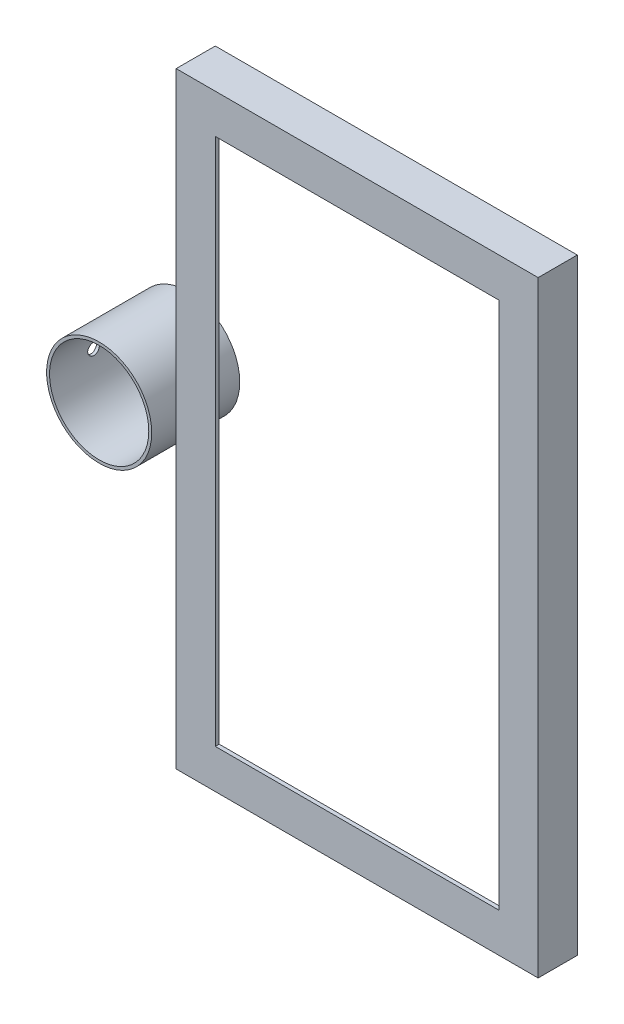
from build123d import *

# Parameters (mm, degrees)
SKETCH1_R               = 26.85
SKETCH1_R_2             = 25.35
BOSS_EXTRUDE1_DEPTH     = 45
CUT_EXTRUDE2_REACH      = 77.031
CUT_EXTRUDE2_END_RADIUS = 25.35
SKETCH2_R               = 3
SKETCH9_W               = 185
SKETCH9_H               = 310
SKETCH9_W_2             = 145
SKETCH9_H_2             = 270
BOSS_EXTRUDE2_DEPTH     = 10
SHELL3_T                = -2


with BuildPart() as part:
    # Sketch1 → Boss-Extrude1 (new body)
    with BuildSketch(Plane.XY):
        with Locations(Location((0, 0, 0), (0, 0, 180))):
            Circle(SKETCH1_R)
        with Locations(Location((0, 0, 0), (0, 0, 180))):
            Circle(SKETCH1_R_2, mode=Mode.SUBTRACT)
    extrude(amount=BOSS_EXTRUDE1_DEPTH)

    # Cut-Extrude2: up to this cylinder (the profile starts outside it)
    cut_extrude2_end = Plane(origin=(0, 0, 22.5), z_dir=(0, 0, -1)) * Cylinder(CUT_EXTRUDE2_END_RADIUS, 205.762, mode=Mode.PRIVATE)
    # Sketch2 → Cut-Extrude2 (cut, up to the surface)
    with BuildSketch(Plane.ZY.offset(26.85), mode=Mode.PRIVATE) as cut_extrude2_sk1:
        with Locations((22.5, 0)):
            Circle(SKETCH2_R)
    cut_extrude2_tool1 = extrude(cut_extrude2_sk1.sketch, amount=-CUT_EXTRUDE2_REACH, mode=Mode.PRIVATE) - cut_extrude2_end
    add(cut_extrude2_tool1.solids().sort_by_distance((-26.85, 0, 22.5))[0], mode=Mode.SUBTRACT)


with BuildPart() as body_2:
    # Sketch9 → Boss-Extrude2 (new, symmetric)
    with BuildSketch(Plane.XY.offset(22.5)):
        with Locations((119.35, 0)):
            Rectangle(SKETCH9_W, SKETCH9_H)
        with Locations((119.35, 0)):
            Rectangle(SKETCH9_W_2, SKETCH9_H_2, mode=Mode.SUBTRACT)
    extrude(amount=BOSS_EXTRUDE2_DEPTH, both=True)

    # Shell3
    shell3_openings = [body_2.faces().sort_by_distance(p)[0] for p in [
        (119.35, 151.389944599, 12.5),
        (46.85, 0, 22.5),
        (119.35, -135, 22.5),
        (191.85, 0, 22.5),
        (119.35, 135, 22.5),
    ]]
    offset(amount=SHELL3_T, openings=shell3_openings, kind=Kind.INTERSECTION)


solid = Compound([part.part, body_2.part])
